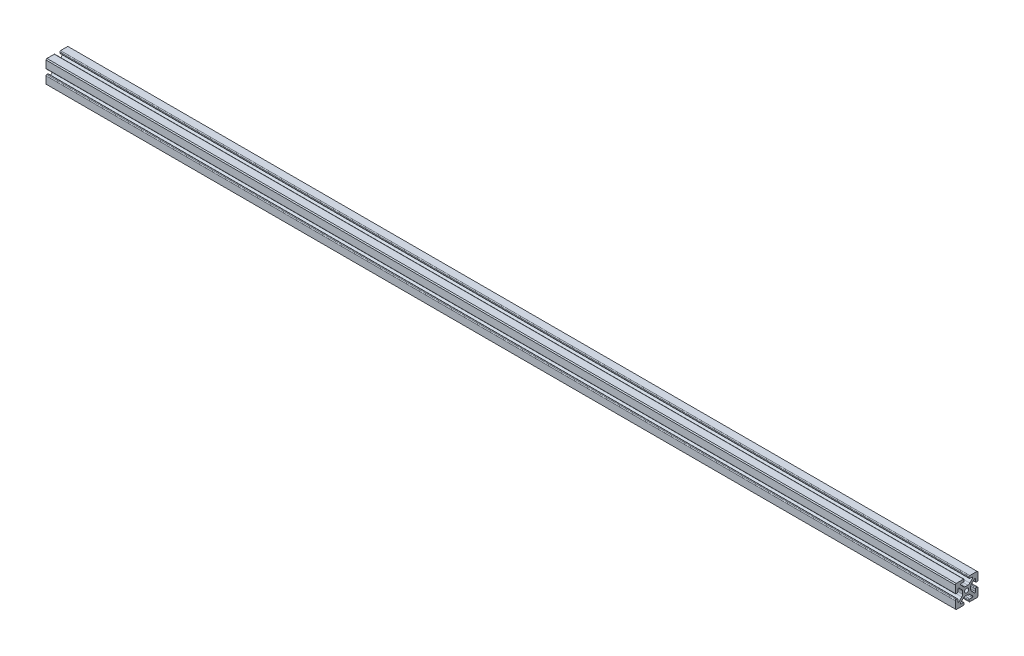
from build123d import *

# Parameters (mm, degrees)
SKETCH1_R           = 3.4036
BOSS_EXTRUDE1_DEPTH = 1524


with BuildPart() as part:
    # Sketch1 → Boss-Extrude1 (new body)
    with BuildSketch(Plane(origin=(0, 0, 0), x_dir=(0, -1, 0), z_dir=(-1, 0, 0))):
        with BuildLine():
            Line((19.05, 5.333992226), (19.05, 17.526))
            Line((19.05, 17.526), (17.526, 19.05))
            Line((17.526, 19.05), (5.333991729, 19.05))
            ThreePointArc((5.333991729, 19.05), (4.435966117, 18.678025612), (4.063991729, 17.78))
            Line((4.063991729, 17.78), (4.063991729, 16.12658277))
            ThreePointArc((4.063991729, 16.12658277), (4.435966117, 15.228557158), (5.333991729, 14.85658277))
            Line((5.333991729, 14.85658277), (9.096353874, 14.85658277))
            ThreePointArc((9.096353874, 14.85658277), (9.938252886, 14.507856781), (10.286978874, 13.66595777))
            Line((10.286978874, 13.66595777), (10.286978874, 13.653830065))
            ThreePointArc((10.286978874, 13.653830065), (10.196347959, 13.198197641), (9.938252944, 12.811931112))
            Line((9.938252944, 12.811931112), (5.277611896, 8.151289413))
            ThreePointArc((5.277611896, 8.151289413), (3.732545616, 7.118909013), (1.910015615, 6.756385223))
            Line((1.910015615, 6.756385223), (-1.910018596, 6.756385223))
            ThreePointArc((-1.910018596, 6.756385223), (-3.732548289, 7.118908885), (-5.277614406, 8.151288942))
            Line((-5.277614406, 8.151288942), (-9.93825393, 12.811927815))
            ThreePointArc((-9.93825393, 12.811927815), (-10.19634903, 13.198194385), (-10.286979978, 13.653826886))
            Line((-10.286979978, 13.653826886), (-10.286979978, 13.66595777))
            ThreePointArc((-10.286979978, 13.66595777), (-9.938253989, 14.507856781), (-9.096354978, 14.85658277))
            Line((-9.096354978, 14.85658277), (-5.333992226, 14.85658277))
            ThreePointArc((-5.333992226, 14.85658277), (-4.435966614, 15.228557158), (-4.063992226, 16.12658277))
            Line((-4.063992226, 16.12658277), (-4.063992226, 17.78))
            ThreePointArc((-4.063992226, 17.78), (-4.435966614, 18.678025612), (-5.333992226, 19.05))
            Line((-5.333992226, 19.05), (-17.526, 19.05))
            Line((-17.526, 19.05), (-19.05, 17.526))
            Line((-19.05, 17.526), (-19.05, 5.333992226))
            ThreePointArc((-19.05, 5.333992226), (-18.678025612, 4.435966614), (-17.78, 4.063992226))
            Line((-17.78, 4.063992226), (-16.12658277, 4.063992226))
            ThreePointArc((-16.12658277, 4.063992226), (-15.228557158, 4.435966614), (-14.85658277, 5.333992226))
            Line((-14.85658277, 5.333992226), (-14.85658277, 9.096354978))
            ThreePointArc((-14.85658277, 9.096354978), (-14.507856781, 9.938253989), (-13.66595777, 10.286979978))
            Line((-13.66595777, 10.286979978), (-13.653827218, 10.286979978))
            ThreePointArc((-13.653827218, 10.286979978), (-13.198194795, 10.196349062), (-12.811928266, 9.938254048))
            Line((-12.811928266, 9.938254048), (-8.151289413, 5.277615846))
            ThreePointArc((-8.151289413, 5.277615846), (-7.118909013, 3.732549566), (-6.756385223, 1.910019566))
            Line((-6.756385223, 1.910019566), (-6.756385223, -1.910017492))
            ThreePointArc((-6.756385223, -1.910017492), (-7.118908885, -3.732547185), (-8.151288942, -5.277613302))
            Line((-8.151288942, -5.277613302), (-12.811927815, -9.938252827))
            ThreePointArc((-12.811927815, -9.938252827), (-13.198194385, -10.196347927), (-13.653826886, -10.286978874))
            Line((-13.653826886, -10.286978874), (-13.66595777, -10.286978874))
            ThreePointArc((-13.66595777, -10.286978874), (-14.507856781, -9.938252886), (-14.85658277, -9.096353874))
            Line((-14.85658277, -9.096353874), (-14.85658277, -5.333991729))
            ThreePointArc((-14.85658277, -5.333991729), (-15.228557158, -4.435966117), (-16.12658277, -4.063991729))
            Line((-16.12658277, -4.063991729), (-17.78, -4.063991729))
            ThreePointArc((-17.78, -4.063991729), (-18.678025612, -4.435966117), (-19.05, -5.333991729))
            Line((-19.05, -5.333991729), (-19.05, -17.526))
            Line((-19.05, -17.526), (-17.526, -19.05))
            Line((-17.526, -19.05), (-5.333992226, -19.05))
            ThreePointArc((-5.333992226, -19.05), (-4.435966614, -18.678025612), (-4.063992226, -17.78))
            Line((-4.063992226, -17.78), (-4.063992226, -16.126583724))
            ThreePointArc((-4.063992226, -16.126583724), (-4.435966614, -15.228558112), (-5.333992226, -14.856583724))
            Line((-5.333992226, -14.856583724), (-9.096354978, -14.856583724))
            ThreePointArc((-9.096354978, -14.856583724), (-9.938253989, -14.507857736), (-10.286979978, -13.665958724))
            Line((-10.286979978, -13.665958724), (-10.286979978, -13.653828173))
            ThreePointArc((-10.286979978, -13.653828173), (-10.196349062, -13.198195749), (-9.938254048, -12.81192922))
            Line((-9.938254048, -12.81192922), (-5.277615159, -8.15128968))
            ThreePointArc((-5.277615159, -8.15128968), (-3.732548878, -7.11890928), (-1.910018878, -6.75638549))
            Line((-1.910018878, -6.75638549), (1.910021709, -6.75638549))
            ThreePointArc((1.910021709, -6.75638549), (3.732551402, -7.118909152), (5.277617519, -8.151289209))
            Line((5.277617519, -8.151289209), (9.938252827, -12.811923865))
            ThreePointArc((9.938252827, -12.811923865), (10.196347927, -13.198190435), (10.286978874, -13.653822935))
            Line((10.286978874, -13.653822935), (10.286978874, -13.665958724))
            ThreePointArc((10.286978874, -13.665958724), (9.938252886, -14.507857736), (9.096353874, -14.856583724))
            Line((9.096353874, -14.856583724), (5.333991729, -14.856583724))
            ThreePointArc((5.333991729, -14.856583724), (4.435966117, -15.228558112), (4.063991729, -16.126583724))
            Line((4.063991729, -16.126583724), (4.063991729, -17.78))
            ThreePointArc((4.063991729, -17.78), (4.435966117, -18.678025612), (5.333991729, -19.05))
            Line((5.333991729, -19.05), (17.526, -19.05))
            Line((17.526, -19.05), (19.05, -17.526))
            Line((19.05, -17.526), (19.05, -5.333991729))
            ThreePointArc((19.05, -5.333991729), (18.678025612, -4.435966117), (17.78, -4.063991729))
            Line((17.78, -4.063991729), (16.126583724, -4.063991729))
            ThreePointArc((16.126583724, -4.063991729), (15.228558112, -4.435966117), (14.856583724, -5.333991729))
            Line((14.856583724, -5.333991729), (14.856583724, -9.096353874))
            ThreePointArc((14.856583724, -9.096353874), (14.507857736, -9.938252886), (13.665958724, -10.286978874))
            Line((13.665958724, -10.286978874), (13.653828961, -10.286978874))
            ThreePointArc((13.653828961, -10.286978874), (13.198196538, -10.196347959), (12.811930009, -9.938252944))
            Line((12.811930009, -9.938252944), (8.151290074, -5.277613661))
            ThreePointArc((8.151290074, -5.277613661), (7.118909674, -3.732547381), (6.756385884, -1.91001738))
            Line((6.756385884, -1.91001738), (6.756385884, 1.910021149))
            ThreePointArc((6.756385884, 1.910021149), (7.118909547, 3.732550842), (8.151289603, 5.277616959))
            Line((8.151289603, 5.277616959), (12.811925923, 9.93825393))
            ThreePointArc((12.811925923, 9.93825393), (13.198192493, 10.19634903), (13.653824993, 10.286979978))
            Line((13.653824993, 10.286979978), (13.665958724, 10.286979978))
            ThreePointArc((13.665958724, 10.286979978), (14.507857736, 9.938253989), (14.856583724, 9.096354978))
            Line((14.856583724, 9.096354978), (14.856583724, 5.333992226))
            ThreePointArc((14.856583724, 5.333992226), (15.228558112, 4.435966614), (16.126583724, 4.063992226))
            Line((16.126583724, 4.063992226), (17.78, 4.063992226))
            ThreePointArc((17.78, 4.063992226), (18.678025612, 4.435966614), (19.05, 5.333992226))
        make_face()
        with Locations(Location((0, 0, 0), (0, 0, 270))):
            Circle(SKETCH1_R, mode=Mode.SUBTRACT)
    extrude(amount=-BOSS_EXTRUDE1_DEPTH)


solid = part.part
